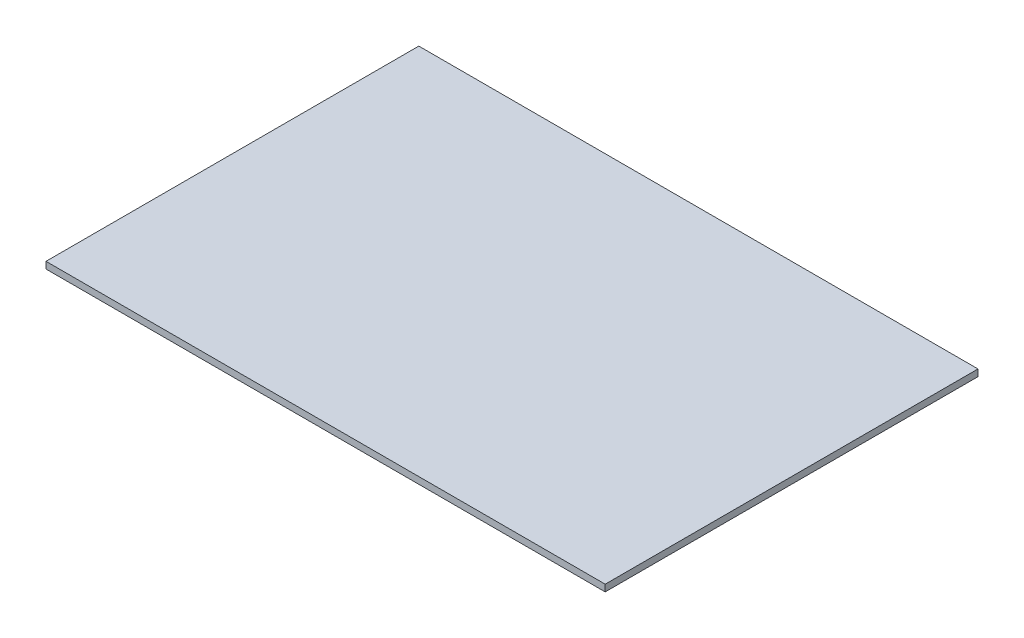
from build123d import *

# Parameters (mm, degrees)
ESQUISSE1_W        = 1500
ESQUISSE1_H        = 1000
BOSS_EXTRU_1_DEPTH = 18


with BuildPart() as part:
    # Esquisse1 → Boss.-Extru.1 (new body)
    with BuildSketch(Plane(origin=(0, 0, 0), x_dir=(1, 0, 0), z_dir=(0, 1, 0))):
        Rectangle(ESQUISSE1_W, ESQUISSE1_H)
    extrude(amount=BOSS_EXTRU_1_DEPTH)


solid = part.part
